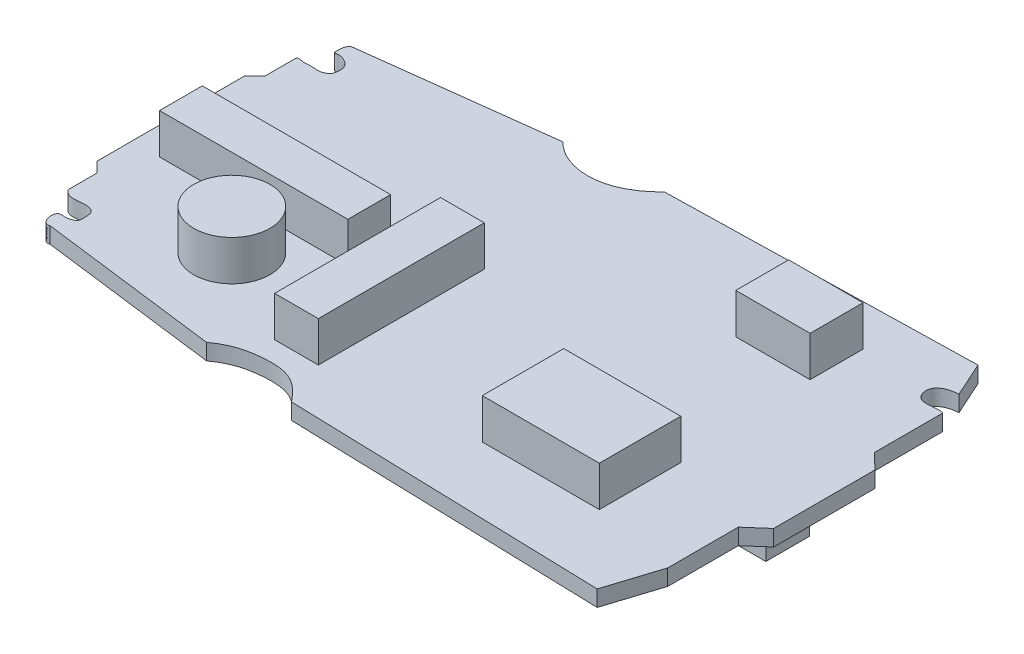
from build123d import *

# Parameters (mm, degrees)
EXTRUDE_1_DEPTH = 1.2
SKETCH_2_R      = 2.845685889
SKETCH_2_W      = 8.739987145
SKETCH_2_H      = 6.079991058
SKETCH_2_W_2    = 5.547991841
SKETCH_2_H_2    = 3.951994188
SKETCH_2_W_3    = 14.059979321
SKETCH_2_H_3    = 3.191995305
SKETCH_2_W_4    = 3.267995194
SKETCH_2_H_4    = 12.38798178
EXTRUDE_2_DEPTH = 3
SKETCH_3_W      = 2.683606537
SKETCH_3_H      = 3.252856408
SKETCH_3_W_2    = 2.846249357
SKETCH_3_W_3    = 3.008892177
EXTRUDE_3_DEPTH = 2.5


with BuildPart() as part:
    # 草图1 → 凸台-拉伸1 (new body)
    with BuildSketch(Plane(origin=(0, 0, 0), x_dir=(1, 0, 0), z_dir=(0, 1, 0))):
        with BuildLine():
            Line((26.542234899, 34.28501498), (26.542234899, 23.235578727))
            Line((26.542234899, 23.235578727), (27.30719587, 22.470617756))
            Line((27.30719587, 22.470617756), (27.30719587, 20.345726169))
            add(Edge.make_bspline(
                [(27.30719587, 20.345726169), (27.766366726, 19.710473493), (28.533192041, 20.17567494), (29.707597035, 19.856281374), (29.708705733, 19.21261025), (29.749927114, 18.697849945), (29.332093975, 18.49948094), (28.972099363, 18.416631461), (28.09146585, 18.591532269), (28.396219588, 17.109853086), (28.964611308, 17.328380115)],
                knots=[0, 0, 0, 0, 0.289961436, 0.402397786, 0.499466996, 0.579199453, 0.625291902, 0.705975123, 0.770289418, 1, 1, 1, 1], degree=3))
            Line((28.964611308, 17.328380115), (42.351428307, 15.628466845))
            add(Edge.make_bspline(
                [(42.351428307, 15.628466845), (43.299365142, 16.370621016), (45.080658031, 16.834578894), (47.822138144, 16.706281246), (48.888212373, 15.536804191), (49.363570545, 14.948501537)],
                knots=[0, 0, 0, 0, 0.445650104, 0.701196625, 1, 1, 1, 1], degree=3))
            Line((49.363570545, 14.948501537), (72.864871499, 14.268536229))
            Line((72.864871499, 14.268536229), (74.139806451, 18.263332413))
            Line((74.139806451, 18.263332413), (74.139806451, 23.533063549))
            Line((74.139806451, 23.533063549), (75.542234899, 24.76550067))
            Line((75.542234899, 24.76550067), (75.542234899, 32.33011472))
            Line((75.542234899, 32.33011472), (74.394793442, 33.435058346))
            Line((74.394793442, 33.435058346), (74.394793442, 38.534798155))
            add(Edge.make_bspline(
                [(74.394793442, 38.534798155), (74.008968349, 38.755438485), (72.555688158, 38.085290889), (72.06904566, 40.063916184), (73.345250089, 40.358200505), (73.783172645, 40.358894346)],
                knots=[0, 0, 0, 0, 0.405657606, 0.627639172, 1, 1, 1, 1], degree=3))
            Line((73.783172645, 40.358894346), (72.609884509, 42.954572656))
            Line((72.609884509, 42.954572656), (49.703553199, 42.444598675))
            add(Edge.make_bspline(
                [(42.691410961, 41.892126862), (43.709779178, 40.816409962), (46.555302503, 40.12135972), (48.90606063, 41.598404573), (49.703553199, 42.444598675)],
                knots=[0, 0, 0, 0, 0.550222151, 1, 1, 1, 1], degree=3))
            Line((42.691410961, 41.892126862), (28.624628654, 40.149715761))
            add(Edge.make_bspline(
                [(27.30719587, 37.259863202), (27.314631273, 37.521835862), (27.83069071, 37.292457691), (28.353409591, 37.437127103), (28.876361187, 37.314153988), (29.318642161, 37.435275806), (29.642981163, 37.616513103), (29.737932693, 37.999534231), (29.755327437, 38.364651638), (29.597769614, 38.753626796), (29.303190466, 38.978604337), (28.951869554, 39.131064843), (28.681716421, 39.165816683), (28.311148089, 39.104787343), (28.381856335, 39.379281333), (28.349673781, 39.705099267), (28.436926255, 40.018809553), (28.624628654, 40.149715761)],
                knots=[0, 0, 0, 0, 0.103745759, 0.179480698, 0.291749409, 0.356068651, 0.410237906, 0.46747416, 0.543083375, 0.593547176, 0.671677835, 0.723593794, 0.780978391, 0.824016838, 0.858913398, 0.887993865, 1, 1, 1, 1], degree=3))
            Line((27.30719587, 37.259863202), (27.30719587, 35.049975952))
            Line((27.30719587, 35.049975952), (26.542234899, 34.28501498))
        make_face()
    extrude(amount=EXTRUDE_1_DEPTH)

    # 草图2 → 凸台-拉伸2 (add)
    with BuildSketch(Plane(origin=(0, 1.2, 0), x_dir=(1, 0, 0), z_dir=(0, 1, 0))):
        with Locations(Location((37.495180045, 22.365434172, 0), (0, 0, 270))):
            Circle(SKETCH_2_R)
        with Locations((63.449141874, 22.517433948)):
            Rectangle(SKETCH_2_W, SKETCH_2_H)
        with Locations((64.513140308, 37.717411593)):
            Rectangle(SKETCH_2_W_2, SKETCH_2_H_2)
        with Locations((35.633182784, 27.457426682)):
            Rectangle(SKETCH_2_W_3, SKETCH_2_H_3)
        with Locations((46.349167023, 24.531430986)):
            Rectangle(SKETCH_2_W_4, SKETCH_2_H_4)
    extrude(amount=EXTRUDE_2_DEPTH)

    # 草图3 → 凸台-拉伸3 (add)
    with BuildSketch(Plane(origin=(0, 0, 0), x_dir=(-1, 0, 0), z_dir=(0, -1, 0))):
        with Locations((-31.036851076, 27.66097912)):
            Rectangle(SKETCH_3_W, SKETCH_3_H)
        with Locations((-51.855132088, 27.66097912)):
            Rectangle(SKETCH_3_W_2, SKETCH_3_H)
        with Locations((-72.185484637, 27.66097912)):
            Rectangle(SKETCH_3_W_3, SKETCH_3_H)
    extrude(amount=EXTRUDE_3_DEPTH)


solid = part.part
